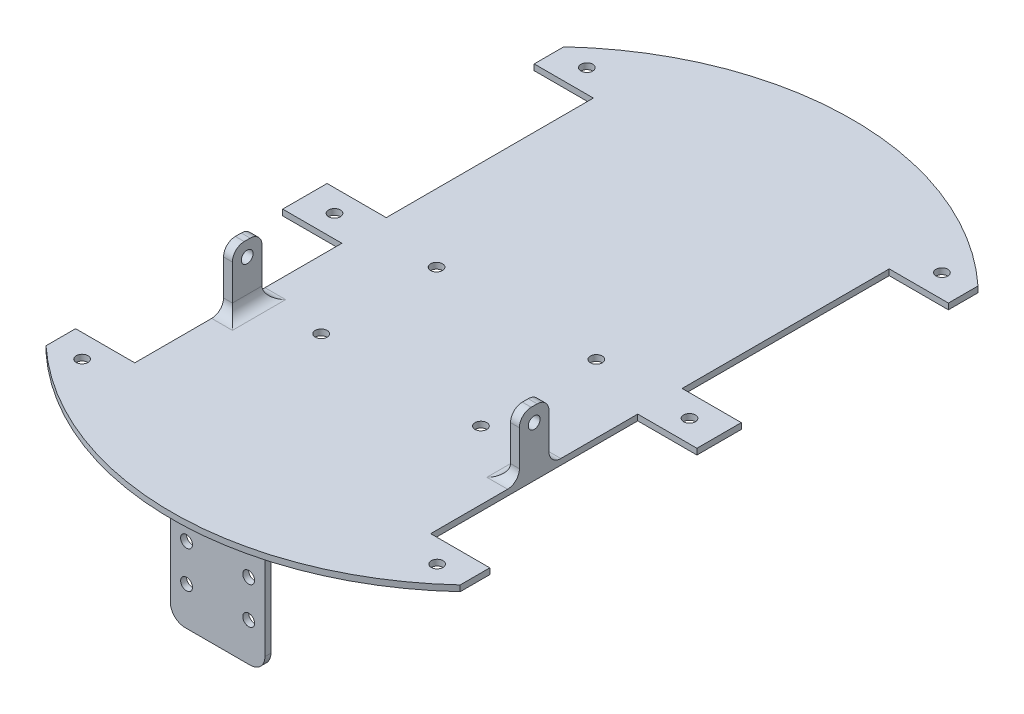
from build123d import *

# Parameters (mm, degrees)
BOSS_EXTRUDE1_DEPTH     = 2
SKETCH3_W               = 3
SKETCH3_H               = 10
BOSS_EXTRUDE2_DEPTH     = 20
SKETCH4_R               = 2
CUT_EXTRUDE2_DEPTH      = 259.984555524
FILLET1_R               = 4
FILLET1_OF_MIRROR1_R    = 4
SKETCH5_R               = 2
CUT_EXTRUDE3_DEPTH      = 242.246761636
CUT_EXTRUDE4_DEPTH      = 242.420794465
CUT_EXTRUDE4_DEPTH_BACK = 242.420794465
SKETCH6_R               = 2
SKETCH7_W               = 32
SKETCH7_H               = 2
BOSS_EXTRUDE3_DEPTH     = 45
FILLET3_R               = 5
FILLET4_R               = 5
SKETCH8_R               = 2
CUT_EXTRUDE5_DEPTH      = 231.076617673


with BuildPart() as part:
    # Sketch1 → Boss-Extrude1 (new body)
    with BuildSketch(Plane(origin=(0, 0, 0), x_dir=(1, 0, 0), z_dir=(0, 1, 0))):
        with BuildLine():
            Line((70, -27.5), (70, -37.5))
            Line((70, -37.5), (50, -37.5))
            Line((50, -37.5), (50, -107.5))
            Line((50, -107.5), (70, -107.5))
            Line((70, -107.5), (70, -122.5))
            Line((70, -122.5), (50, -122.5))
            Line((50, -122.5), (50, -192.5))
            Line((50, -192.5), (70, -192.5))
            Line((70, -192.5), (70, -202.5))
            ThreePointArc((70, -202.5), (0, -230), (-70, -202.5))
            Line((-70, -202.5), (-70, -192.5))
            Line((-70, -192.5), (-50, -192.5))
            Line((-50, -192.5), (-50, -122.5))
            Line((-50, -122.5), (-70, -122.5))
            Line((-70, -122.5), (-70, -107.5))
            Line((-70, -107.5), (-50, -107.5))
            Line((-50, -107.5), (-50, -37.5))
            Line((-50, -37.5), (-70, -37.5))
            Line((-70, -37.5), (-70, -27.5))
            ThreePointArc((-70, -27.5), (0, 0), (70, -27.5))
        make_face()
    extrude(amount=BOSS_EXTRUDE1_DEPTH)

    # Sketch3 → Boss-Extrude2 (add)
    with BuildSketch(Plane(origin=(0, 2, 0), x_dir=(1, 0, 0), z_dir=(0, 1, 0))):
        with Locations((48.5, -157.5)):
            Rectangle(SKETCH3_W, SKETCH3_H)
    boss_extrude2 = extrude(amount=BOSS_EXTRUDE2_DEPTH)

    # Sketch4 → Cut-Extrude2 (cut, through all)
    with BuildSketch(Plane.ZY.offset(-47)):
        with Locations((157.5, 17)):
            Circle(SKETCH4_R)
    cut_extrude2 = extrude(amount=-CUT_EXTRUDE2_DEPTH, mode=Mode.SUBTRACT)

    # Fillet1
    fillet1_edges = [part.edges().sort_by_distance(p)[0] for p in [
        (47, 2, 157.5),
        (48.5, 2, 162.5),
        (48.5, 2, 152.5),
        (48.5, 22, 162.5),
        (48.5, 22, 152.5),
    ]]
    fillet(fillet1_edges, radius=FILLET1_R)

    # Mirror1: Boss-Extrude2, Cut-Extrude2 across plane
    add(boss_extrude2.mirror(Plane(origin=(0, 0, 0), x_dir=(0, 0, 1), z_dir=(1, 0, 0))))
    add(cut_extrude2.mirror(Plane(origin=(0, 0, 0), x_dir=(0, 0, 1), z_dir=(1, 0, 0))), mode=Mode.SUBTRACT)

    # Fillet1 of Mirror1
    fillet1_of_mirror1_edges = [part.edges().sort_by_distance(p)[0] for p in [
        (-47, 2, 157.5),
        (-48.5, 2, 162.5),
        (-48.5, 2, 152.5),
        (-48.5, 22, 162.5),
        (-48.5, 22, 152.5),
    ]]
    fillet(fillet1_of_mirror1_edges, radius=FILLET1_OF_MIRROR1_R)

    # Sketch5 → Cut-Extrude3 (cut, through all)
    with BuildSketch(Plane(origin=(0, 2, 0), x_dir=(1, 0, 0), z_dir=(0, 1, 0))):
        with Locations(Location((-60, -115, 0), (0, 0, 270))):
            Circle(SKETCH5_R)
        with Locations(Location((-60, -200.3, 0), (0, 0, 270))):
            Circle(SKETCH5_R)
        with Locations(Location((-60, -29.7, 0), (0, 0, 270))):
            Circle(SKETCH5_R)
        with Locations(Location((60, -200.3, 0), (0, 0, 90))):
            Circle(SKETCH5_R)
        with Locations(Location((60, -115, 0), (0, 0, 90))):
            Circle(SKETCH5_R)
        with Locations(Location((60, -29.7, 0), (0, 0, 90))):
            Circle(SKETCH5_R)
    extrude(amount=-CUT_EXTRUDE3_DEPTH, mode=Mode.SUBTRACT)

    # Sketch6 → Cut-Extrude4 (cut, two sides: drawn at the far end of the back side and taken through both)
    with BuildSketch(Plane.XZ.offset(-CUT_EXTRUDE4_DEPTH_BACK)):
        with Locations(Location((-27, 152.5, 0), (0, 0, 270))):
            Circle(SKETCH6_R)
        with Locations(Location((27, 152.5, 0), (0, 0, 270))):
            Circle(SKETCH6_R)
        with Locations(Location((-27, 113.5, 0), (0, 0, 270))):
            Circle(SKETCH6_R)
        with Locations(Location((27, 113.5, 0), (0, 0, 270))):
            Circle(SKETCH6_R)
    extrude(amount=CUT_EXTRUDE4_DEPTH + CUT_EXTRUDE4_DEPTH_BACK, mode=Mode.SUBTRACT)

    # Sketch7 → Boss-Extrude3 (add)
    with BuildSketch(Plane.XZ):
        with Locations((0, 213.5)):
            Rectangle(SKETCH7_W, SKETCH7_H)
    extrude(amount=BOSS_EXTRUDE3_DEPTH)

    # Fillet3
    fillet3_edges = [part.edges().sort_by_distance(p)[0] for p in [
        (-16, 0, 213.5),
        (16, 0, 213.5),
        (-16, -45, 213.5),
        (16, -45, 213.5),
    ]]
    fillet(fillet3_edges, radius=FILLET3_R)

    # Fillet4
    fillet4_edges = [part.edges().sort_by_distance(p)[0] for p in [
        (0, 0, 212.5),
    ]]
    fillet(fillet4_edges, radius=FILLET4_R)

    # Sketch8 → Cut-Extrude5 (cut, through all)
    with BuildSketch(Plane.XY.offset(214.5)):
        with Locations((-10.5, -19.5)):
            Circle(SKETCH8_R)
        with Locations((10.5, -19.5)):
            Circle(SKETCH8_R)
        with Locations((10.5, -32)):
            Circle(SKETCH8_R)
        with Locations((-10.5, -32)):
            Circle(SKETCH8_R)
    extrude(amount=-CUT_EXTRUDE5_DEPTH, mode=Mode.SUBTRACT)


solid = part.part
